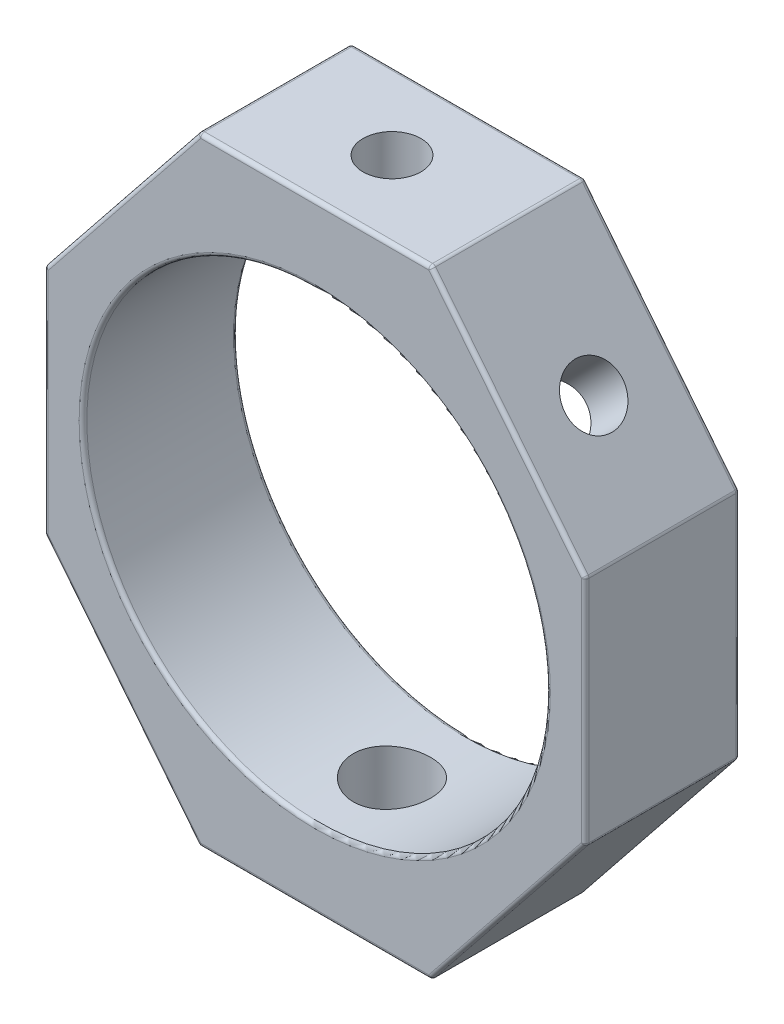
from build123d import *

# Parameters (mm, degrees)
SKETCH1_R           = 12
BOSS_EXTRUDE1_DEPTH = 4
SKETCH3_R           = 1.5
CUT_EXTRUDE1_DEPTH  = 8
SKETCH4_R           = 2
CUT_EXTRUDE2_DEPTH  = 8
FILLET1_R           = 0.2


with BuildPart() as part:
    # Sketch1 → Boss-Extrude1 (new, symmetric)
    with BuildSketch(Plane.XY):
        Polygon((-14, 6), (-14, -6), (-6, -16), (6, -16), (14, -6), (14, 6), (6, 16), (-6, 16), align=None)
        Circle(SKETCH1_R, mode=Mode.SUBTRACT)
    extrude(amount=BOSS_EXTRUDE1_DEPTH, both=True)

    # Sketch2 → Cut-Revolve1 (revolve, cut)
    with BuildSketch(Plane.XY, mode=Mode.PRIVATE) as cut_revolve1_sk:
        Polygon((7.590491025, 7.590491025), (12.891478597, 12.891478597), (11.830818425, 13.952138769), (6.529830853, 8.651151197), align=None)
    revolve(cut_revolve1_sk.sketch.rotate(Axis((7.590491025, 7.590491025, 0), (0.7071067811865511, 0.707106781186544, 0)), 180), axis=Axis((7.590491025, 7.590491025, 0), (0.7071067811865511, 0.707106781186544, 0)), mode=Mode.SUBTRACT)

    # Sketch3 → Cut-Extrude1 (cut)
    with BuildSketch(Plane(origin=(0, 16, 0), x_dir=(1, 0, 0), z_dir=(0, 1, 0))):
        with Locations(Location((0, 0, 0), (0, 0, 270))):
            Circle(SKETCH3_R)
    extrude(amount=-CUT_EXTRUDE1_DEPTH, mode=Mode.SUBTRACT)

    # Sketch4 → Cut-Extrude2 (cut)
    with BuildSketch(Plane.XZ.offset(16)):
        with Locations(Location((0, 0, 0), (0, 0, 270))):
            Circle(SKETCH4_R)
    extrude(amount=-CUT_EXTRUDE2_DEPTH, mode=Mode.SUBTRACT)

    # Fillet1
    fillet1_edges = [part.edges().sort_by_distance(p)[0] for p in [
        (14, 0, -4),
        (10, -11, -4),
        (0, -16, -4),
        (-10, -11, -4),
        (10, -11, 4),
        (-14, -6, 0),
        (-14, 6, 0),
        (-6, 16, 0),
        (6, 16, 0),
        (14, 6, 0),
        (14, -6, 0),
        (6, -16, 0),
        (-6, -16, 0),
        (14, 0, 4),
        (10, 11, 4),
        (-12, 0, -4),
        (-12, 0, 4),
        (0, 16, 4),
        (-10, 11, 4),
        (-14, 0, 4),
        (-10, -11, 4),
        (-14, 0, -4),
        (0, -16, 4),
        (-10, 11, -4),
        (0, 16, -4),
        (10, 11, -4),
    ]]
    fillet(fillet1_edges, radius=FILLET1_R)


solid = part.part
